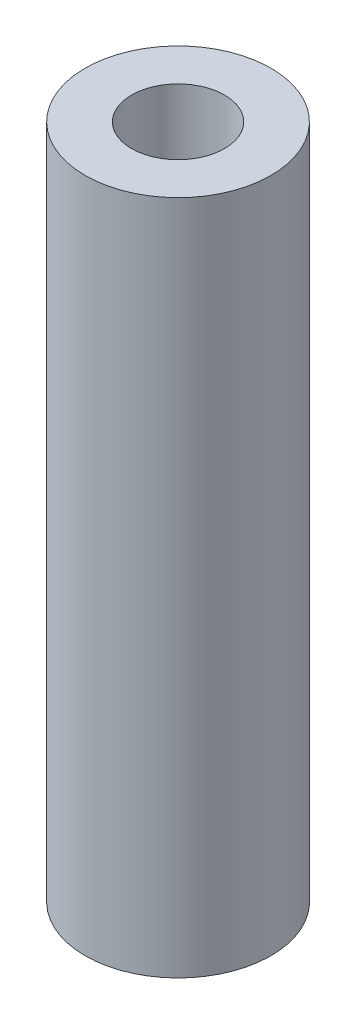
from build123d import *

# Parameters (mm, degrees)
SKETCH1_R           = 11
SKETCH1_R_2         = 5.5
BOSS_EXTRUDE1_DEPTH = 40


with BuildPart() as part:
    # Sketch1 → Boss-Extrude1 (new, symmetric)
    with BuildSketch(Plane(origin=(0, 0, 0), x_dir=(-1, 0, 0), z_dir=(0, 1, 0))):
        with Locations(Location((0, 0, 0), (0, 0, 90))):
            Circle(SKETCH1_R)
        with Locations(Location((0, 0, 0), (0, 0, 90))):
            Circle(SKETCH1_R_2, mode=Mode.SUBTRACT)
    extrude(amount=BOSS_EXTRUDE1_DEPTH, both=True)


solid = part.part
